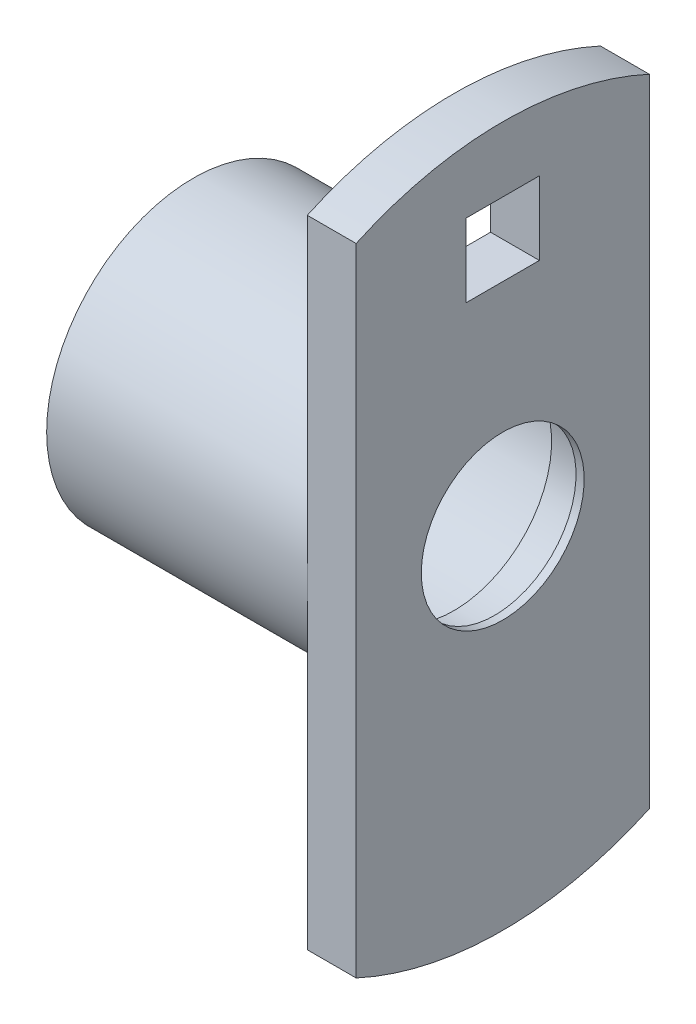
from build123d import *

# Parameters (mm, degrees)
SKETCH2_W          = 9
SKETCH2_H          = 9
CUT_EXTRUDE1_DEPTH = 6


with BuildPart() as part:
    # Sketch1 → Revolve1 (revolve)
    with BuildSketch(Plane.XY, mode=Mode.PRIVATE) as revolve1_sk:
        Polygon((-1, 12), (-6, 12), (-6, 16), (-38, 16), (-38, 18), (-6, 18), (-6, 43), (0, 43), (0, 10), (-1, 10), align=None)
    revolve(revolve1_sk.sketch.rotate(Axis((-42.809570876, 0, 0), (1, 0, 0)), 90), axis=Axis((-42.809570876, 0, 0), (1, 0, 0)))

    # Sketch2 → Cut-Extrude1 (cut)
    with BuildSketch(Plane(origin=(0, 0, 0), x_dir=(0, 0, -1), z_dir=(1, 0, 0))):
        with BuildLine():
            Line((-18, -39.05124838), (-18, 39.05124838))
            ThreePointArc((-18, 39.05124838), (-43, 0), (-18, -39.05124838))
        make_face()
        with Locations((0, 30.5)):
            Rectangle(SKETCH2_W, SKETCH2_H)
        with BuildLine():
            ThreePointArc((43, 0), (36.214637924, 23.184046239), (18, 39.05124838))
            Line((18, 39.05124838), (18, -39.05124838))
            ThreePointArc((18, -39.05124838), (36.214637924, -23.184046239), (43, 0))
        make_face()
    extrude(amount=-CUT_EXTRUDE1_DEPTH, mode=Mode.SUBTRACT)


solid = part.part
